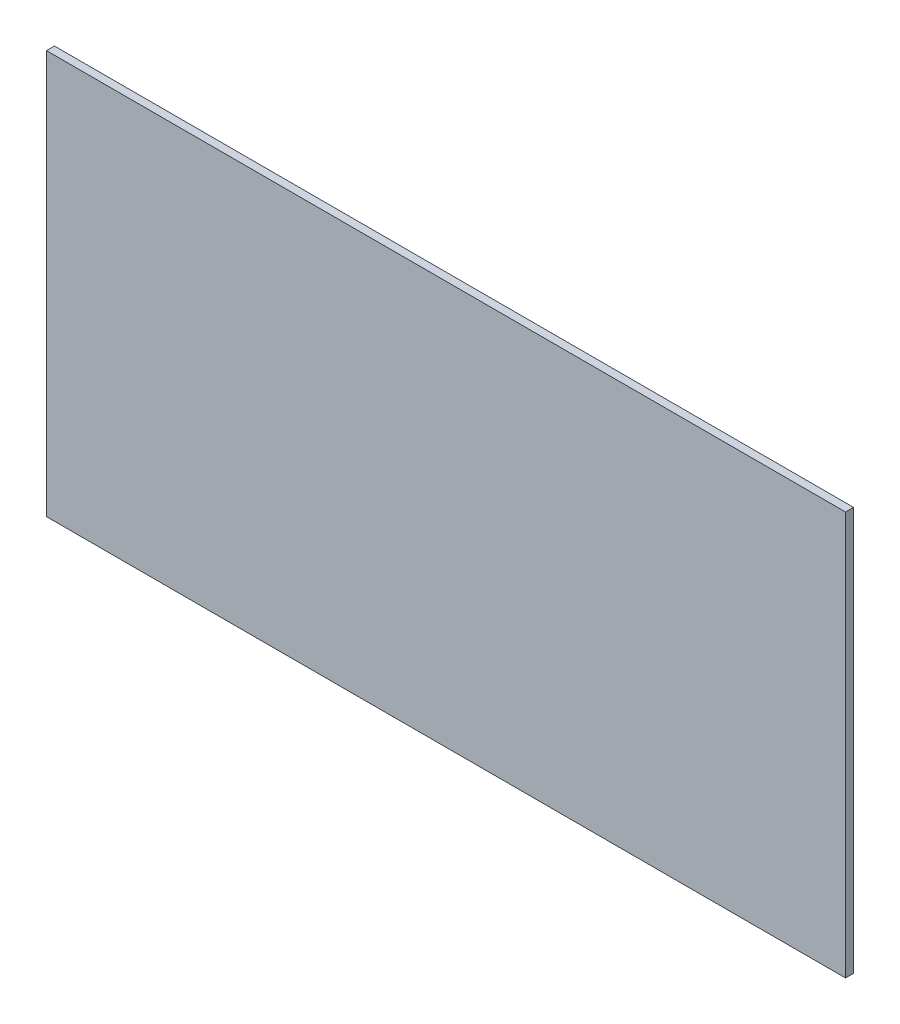
from build123d import *

# Parameters (mm, degrees)
SKETCH1_W           = 254
SKETCH1_H           = 128.27
BOSS_EXTRUDE1_DEPTH = 1.27


with BuildPart() as part:
    # Sketch1 → Boss-Extrude1 (new, symmetric)
    with BuildSketch(Plane.XY):
        Rectangle(SKETCH1_W, SKETCH1_H)
    extrude(amount=BOSS_EXTRUDE1_DEPTH, both=True)


solid = part.part
